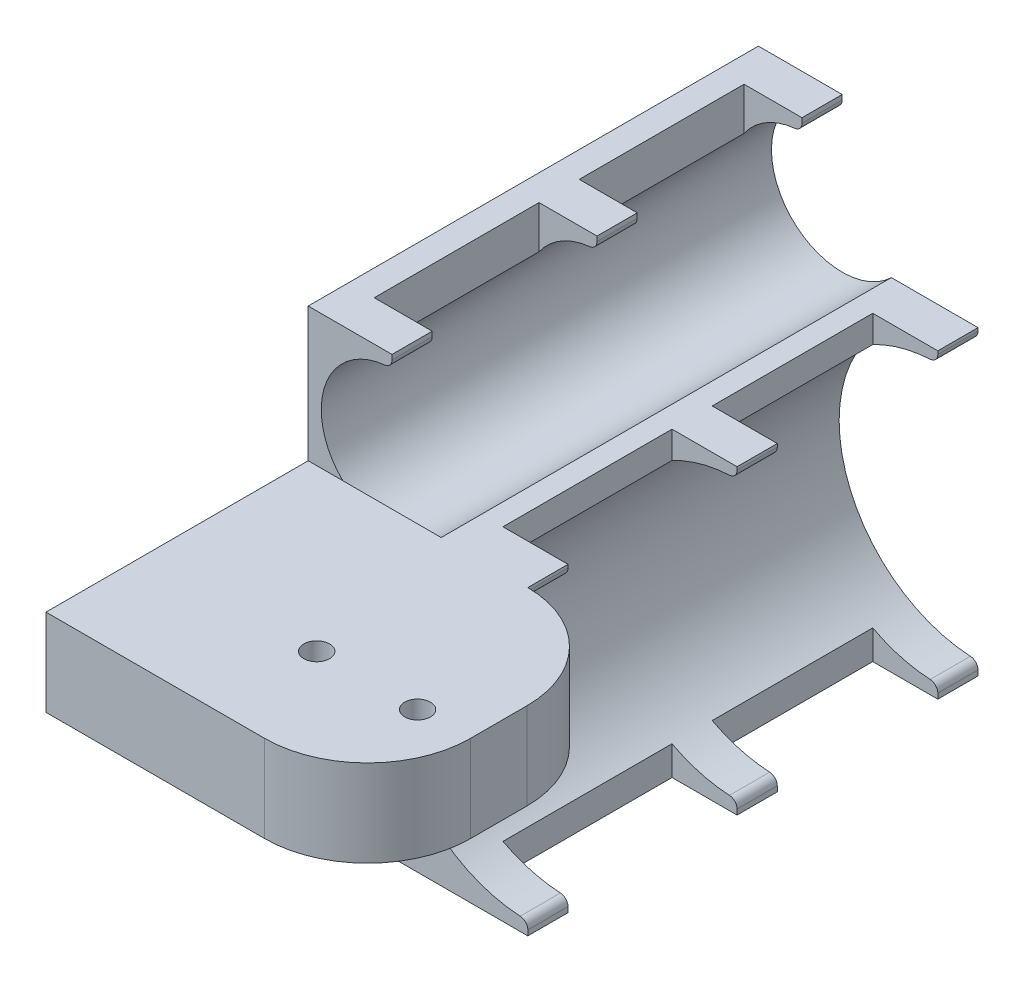
from build123d import *

# Parameters (mm, degrees)
BOSS_EXTRUDE1_DEPTH = 70
SKETCH2_W           = 30.127897987
SKETCH2_H           = 25.625
CUT_EXTRUDE1_DEPTH  = 10
SKETCH3_W           = 36.135462637
SKETCH3_H           = 24.960917338
SKETCH3_H_2         = 26.289082662
CUT_EXTRUDE2_DEPTH  = 88.210896549
SKETCH5_W           = 40.769231001
SKETCH5_H           = 13.5
BOSS_EXTRUDE2_DEPTH = 50
SKETCH6_R           = 2
CUT_EXTRUDE3_DEPTH  = 50
FILLET1_R           = 1.25
FILLET2_R           = 16


with BuildPart() as part:
    # Sketch1 → Boss-Extrude1 (new body)
    with BuildSketch(Plane.XY):
        with BuildLine():
            Line((22.473811518, 84.75800041), (22.473811518, 83.058719541))
            ThreePointArc((22.473811518, 83.058719541), (0.883811518, 61.468719541), (22.473811518, 39.878719541))
            Line((22.473811518, 39.878719541), (22.473811518, 37.846719541))
            Line((22.473811518, 37.846719541), (-11.673355367, 37.846719541))
            Line((-11.673355367, 37.846719541), (-11.673355367, 105.594024014))
            Line((-11.673355367, 105.594024014), (1.358644633, 105.594024014))
            Line((1.358644633, 105.594024014), (1.358644633, 103.665116534))
            ThreePointArc((1.358644633, 103.665116534), (-8.83886186, 88.540693991), (9.005703845, 84.75800041))
            Line((9.005703845, 84.75800041), (22.473811518, 84.75800041))
        make_face()
    extrude(amount=-BOSS_EXTRUDE1_DEPTH)

    # Sketch2 → Cut-Extrude1 (cut)
    with BuildSketch(Plane(origin=(0, 105.594024014, 0), x_dir=(1, 0, 0), z_dir=(0, 1, 0))):
        with Locations((7.409862525, 50.9375)):
            Rectangle(SKETCH2_W, SKETCH2_H)
        with Locations((7.409862525, 19.0625)):
            Rectangle(SKETCH2_W, SKETCH2_H)
    extrude(amount=-CUT_EXTRUDE1_DEPTH, mode=Mode.SUBTRACT)

    # Sketch3 → Cut-Extrude2 (cut, through all)
    with BuildSketch(Plane(origin=(0, 84.75800041, 0), x_dir=(1, 0, 0), z_dir=(0, 1, 0))):
        with Locations((30.426375951, 51.269541331)):
            Rectangle(SKETCH3_W, SKETCH3_H)
        with Locations((30.426375951, 19.394541331)):
            Rectangle(SKETCH3_W, SKETCH3_H_2)
    extrude(amount=-CUT_EXTRUDE2_DEPTH, mode=Mode.SUBTRACT)

    # Sketch5 → Boss-Extrude2 (add)
    with BuildSketch(Plane.ZY.offset(11.673355367)):
        with Locations((20.384615501, 78.00800041)):
            Rectangle(SKETCH5_W, SKETCH5_H)
    extrude(amount=-BOSS_EXTRUDE2_DEPTH)

    # Sketch6 → Cut-Extrude3 (cut)
    with BuildSketch(Plane(origin=(0, 84.75800041, 0), x_dir=(1, 0, 0), z_dir=(0, 1, 0))):
        with Locations(Location((14.647627353, -25, 0), (0, 0, 270))):
            Circle(SKETCH6_R)
        with Locations(Location((30.329421103, -25, 0), (0, 0, 270))):
            Circle(SKETCH6_R)
    extrude(amount=-CUT_EXTRUDE3_DEPTH, mode=Mode.SUBTRACT)

    # Fillet1
    fillet1_edges = [part.edges().sort_by_distance(p)[0] for p in [
        (1.358644633, 103.665116534, -66.875),
        (22.473811518, 83.058719541, -66.875),
        (22.473811518, 39.878719541, -66.875),
        (1.358644633, 103.665116534, -35),
        (1.358644633, 103.665116534, -3.125),
        (22.473811518, 39.878719541, -35.664082662),
        (22.473811518, 39.878719541, -3.125),
        (22.473811518, 83.058719541, -35.664082662),
        (22.473811518, 83.058719541, -3.125),
    ]]
    fillet(fillet1_edges, radius=FILLET1_R)

    # Fillet2
    fillet2_edges = [part.edges().sort_by_distance(p)[0] for p in [
        (38.326644633, 78.00800041, 0),
        (38.326644633, 78.00800041, 40.769231001),
    ]]
    fillet(fillet2_edges, radius=FILLET2_R)


solid = part.part
